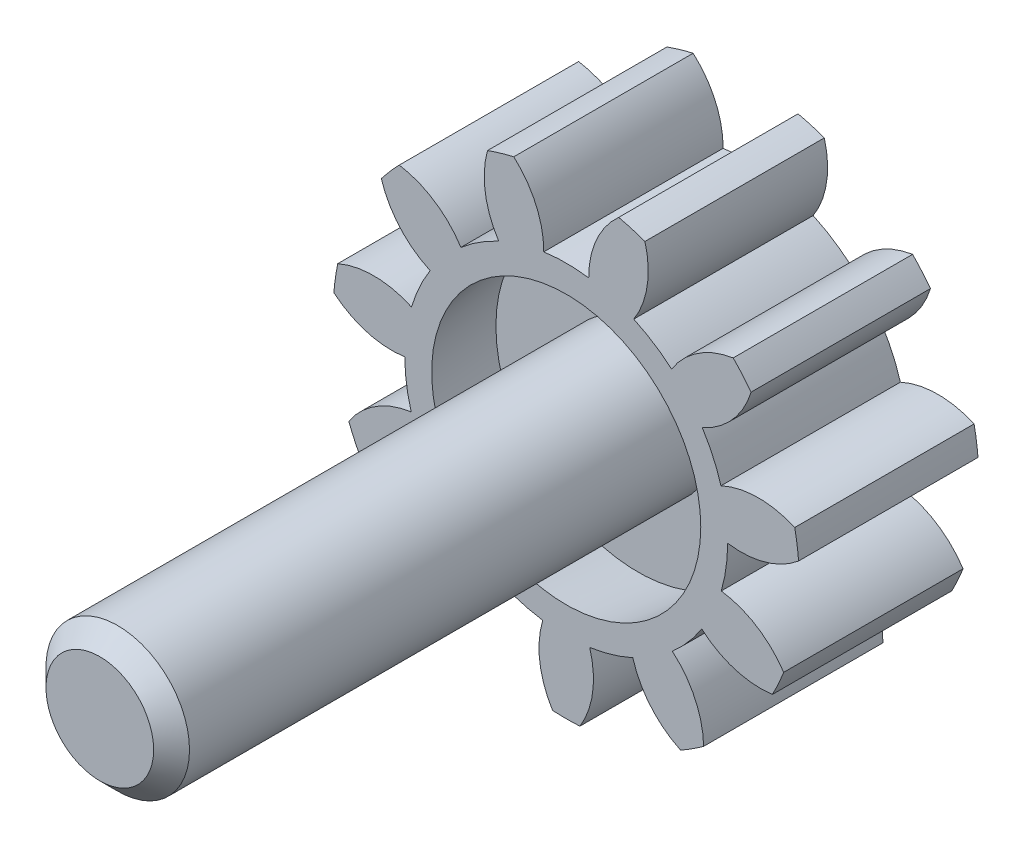
from build123d import *

# Parameters (mm, degrees)
SKETCH_1_R          = 13
EXTRUDE_2_DEPTH     = 10
CUT_EXTRUDE_1_DEPTH = 21.928449536
SKETCH_3_R          = 7.5
CUT_EXTRUDE_2_DEPTH = 4
CUT_EXTRUDE_2_DRAFT = 6
SKETCH_4_R          = 7.5
CUT_EXTRUDE_3_DEPTH = 4
CUT_EXTRUDE_3_DRAFT = 6
SKETCH_5_R          = 4
EXTRUDE_3_DEPTH     = 30
CHAMFER_1_SIZE      = 1


with BuildPart() as part:
    # Эскиз1 → Бобышка-Вытянуть2 (new body)
    with BuildSketch(Plane.XY):
        Circle(SKETCH_1_R)
    extrude(amount=-EXTRUDE_2_DEPTH)

    # Эскиз2 → Вырез-Вытянуть1 (cut, through all)
    with BuildSketch(Plane.XY):
        with BuildLine():
            ThreePointArc((1.252557909, 8.912412619), (0, 9), (-1.252557909, 8.912412619))
            ThreePointArc((-1.252557909, 8.912412619), (-1.684886314, 10.969320472), (-2.924363706, 12.666810842))
            ThreePointArc((-2.924363706, 12.666810842), (0, 13), (2.924363706, 12.666810842))
            ThreePointArc((2.924363706, 12.666810842), (1.684886314, 10.969320472), (1.252557909, 8.912412619))
        make_face()
        with BuildLine():
            ThreePointArc((9.308326268, 9.074968986), (7.028330627, 10.936295927), (4.388063669, 12.237029756))
            ThreePointArc((4.388063669, 12.237029756), (4.513045823, 10.138897913), (3.764695278, 8.174782533))
            ThreePointArc((3.764695278, 8.174782533), (4.865767357, 7.571281795), (5.872132809, 6.82041467))
            ThreePointArc((5.872132809, 6.82041467), (7.34787895, 8.317061286), (9.308326268, 9.074968986))
        make_face()
        with BuildLine():
            ThreePointArc((12.736961008, 2.601888597), (11.82521594, 5.400395169), (10.307311834, 7.922078184))
            ThreePointArc((10.307311834, 7.922078184), (9.278117798, 6.089446906), (7.586684314, 4.841716754))
            ThreePointArc((7.586684314, 4.841716754), (8.186687958, 3.738735117), (8.627347034, 2.562983254))
            ThreePointArc((8.627347034, 2.562983254), (10.677971938, 3.024193907), (12.736961008, 2.601888597))
        make_face()
        with BuildLine():
            ThreePointArc((12.121700624, -4.697273037), (12.867678744, -1.850092898), (12.95406132, 1.091922764))
            ThreePointArc((12.95406132, 1.091922764), (11.097452929, 0.106639531), (8.999954685, -0.028559885))
            ThreePointArc((8.999954685, -0.028559885), (8.908392977, -1.280833544), (8.643439533, -2.508177236))
            ThreePointArc((8.643439533, -2.508177236), (10.617884283, -3.228833669), (12.121700624, -4.697273037))
        make_face()
        with BuildLine():
            ThreePointArc((7.657885939, -10.505083671), (9.824744467, -8.513189541), (11.487987866, -6.084910418))
            ThreePointArc((11.487987866, -6.084910418), (9.393425165, -5.910025141), (7.555803034, -4.889768962))
            ThreePointArc((7.555803034, -4.889768962), (6.801746169, -5.893746606), (5.915301052, -6.783009175))
            ThreePointArc((5.915301052, -6.783009175), (7.186693389, -8.456729369), (7.657885939, -10.505083671))
        make_face()
        with BuildLine():
            ThreePointArc((0.762746577, -12.977604465), (3.662523239, -12.473408657), (6.374559434, -11.329827537))
            ThreePointArc((6.374559434, -11.329827537), (4.707051283, -10.050298589), (3.712737307, -8.198510943))
            ThreePointArc((3.712737307, -8.198510943), (2.535593012, -8.635436763), (1.309096282, -8.904283628))
            ThreePointArc((1.309096282, -8.904283628), (1.473778124, -10.999673247), (0.762746577, -12.977604465))
        make_face()
        with BuildLine():
            ThreePointArc((-6.374559434, -11.329827537), (-3.662523239, -12.473408657), (-0.762746577, -12.977604465))
            ThreePointArc((-0.762746577, -12.977604465), (-1.473778124, -10.999673247), (-1.309096282, -8.904283628))
            ThreePointArc((-1.309096282, -8.904283628), (-2.535593012, -8.635436763), (-3.712737307, -8.198510943))
            ThreePointArc((-3.712737307, -8.198510943), (-4.707051283, -10.050298589), (-6.374559434, -11.329827537))
        make_face()
        with BuildLine():
            ThreePointArc((-11.487987866, -6.084910418), (-9.824744467, -8.513189541), (-7.657885939, -10.505083671))
            ThreePointArc((-7.657885939, -10.505083671), (-7.186693389, -8.456729369), (-5.915301052, -6.783009175))
            ThreePointArc((-5.915301052, -6.783009175), (-6.801746169, -5.893746606), (-7.555803034, -4.889768962))
            ThreePointArc((-7.555803034, -4.889768962), (-9.393425165, -5.910025141), (-11.487987866, -6.084910418))
        make_face()
        with BuildLine():
            ThreePointArc((-12.95406132, 1.091922764), (-12.867678744, -1.850092898), (-12.121700624, -4.697273037))
            ThreePointArc((-12.121700624, -4.697273037), (-10.617884283, -3.228833669), (-8.643439533, -2.508177236))
            ThreePointArc((-8.643439533, -2.508177236), (-8.908392977, -1.280833544), (-8.999954685, -0.028559885))
            ThreePointArc((-8.999954685, -0.028559885), (-11.097452929, 0.106639531), (-12.95406132, 1.091922764))
        make_face()
        with BuildLine():
            ThreePointArc((-10.307311834, 7.922078184), (-11.82521594, 5.400395169), (-12.736961008, 2.601888597))
            ThreePointArc((-12.736961008, 2.601888597), (-10.677971938, 3.024193907), (-8.627347034, 2.562983254))
            ThreePointArc((-8.627347034, 2.562983254), (-8.186687958, 3.738735117), (-7.586684314, 4.841716754))
            ThreePointArc((-7.586684314, 4.841716754), (-9.278117798, 6.089446906), (-10.307311834, 7.922078184))
        make_face()
        with BuildLine():
            ThreePointArc((-4.388063669, 12.237029756), (-7.028330627, 10.936295927), (-9.308326268, 9.074968986))
            ThreePointArc((-9.308326268, 9.074968986), (-7.34787895, 8.317061286), (-5.872132809, 6.82041467))
            ThreePointArc((-5.872132809, 6.82041467), (-4.865767357, 7.571281795), (-3.764695278, 8.174782533))
            ThreePointArc((-3.764695278, 8.174782533), (-4.513045823, 10.138897913), (-4.388063669, 12.237029756))
        make_face()
    extrude(amount=-CUT_EXTRUDE_1_DEPTH, mode=Mode.SUBTRACT)


with BuildPart() as cut_extrude_2_tool:
    # Эскиз3 → Вырез-Вытянуть2 (with draft: the straight prism first)
    with BuildSketch(Plane.XY):
        Circle(SKETCH_3_R)
    extrude(amount=-CUT_EXTRUDE_2_DEPTH)
    # Вырез-Вытянуть2: the draft: its side faces are tilted about the plane it starts from
    cut_extrude_2_sides = [cut_extrude_2_tool.faces().sort_by_distance(p)[0] for p in [
        (-7.5, 0, -2),
    ]]
    draft(cut_extrude_2_sides, Plane.XY, CUT_EXTRUDE_2_DRAFT)


with BuildPart() as part_1:
    add(part.part)

    # Вырез-Вытянуть2: cut by cut_extrude_2_tool
    add(cut_extrude_2_tool.part, mode=Mode.SUBTRACT)


with BuildPart() as cut_extrude_3_tool:
    # Эскиз4 → Вырез-Вытянуть3 (with draft: the straight prism first)
    with BuildSketch(Plane(origin=(0, 0, -10), x_dir=(-1, 0, 0), z_dir=(0, 0, -1))):
        Circle(SKETCH_4_R)
    extrude(amount=-CUT_EXTRUDE_3_DEPTH)
    # Вырез-Вытянуть3: the draft: its side faces are tilted about the plane it starts from
    cut_extrude_3_sides = [cut_extrude_3_tool.faces().sort_by_distance(p)[0] for p in [
        (7.5, 0, -8),
    ]]
    draft(cut_extrude_3_sides, Plane(origin=(0, 0, -10), x_dir=(-1, 0, 0), z_dir=(0, 0, -1)), CUT_EXTRUDE_3_DRAFT)


with BuildPart() as part_2:
    add(part_1.part)

    # Вырез-Вытянуть3: cut by cut_extrude_3_tool
    add(cut_extrude_3_tool.part, mode=Mode.SUBTRACT)

    # Эскиз5 → Бобышка-Вытянуть3 (add)
    with BuildSketch(Plane.XY.offset(-4)):
        Circle(SKETCH_5_R)
    extrude(amount=EXTRUDE_3_DEPTH)

    # Фаска1
    chamfer_1_edges = [part_2.edges().sort_by_distance(p)[0] for p in [
        (-4, 0, 26),
    ]]
    chamfer(chamfer_1_edges, length=CHAMFER_1_SIZE)


solid = part_2.part
